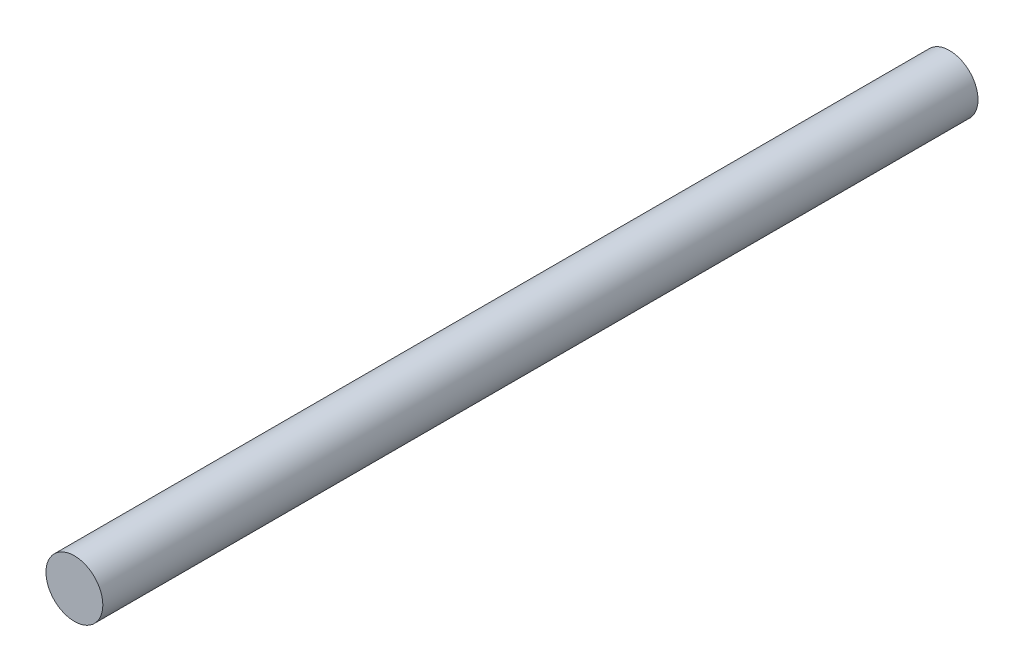
from build123d import *

# Parameters (mm, degrees)
SKETCH1_R           = 1.651
BOSS_EXTRUDE1_DEPTH = 50.8


with BuildPart() as part:
    # Sketch1 → Boss-Extrude1 (new body)
    with BuildSketch(Plane.XY):
        Circle(SKETCH1_R)
    extrude(amount=BOSS_EXTRUDE1_DEPTH)


solid = part.part
